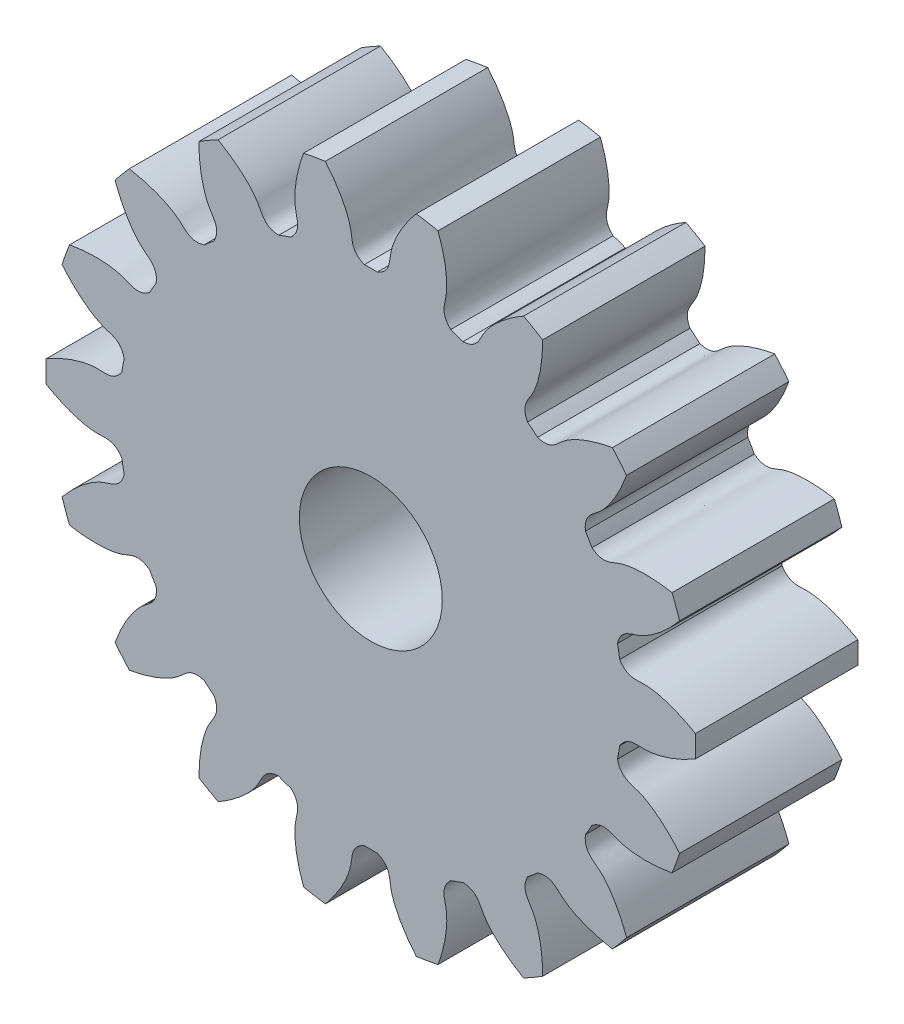
from build123d import *

# Parameters (mm, degrees)
SKETCH_1_R               = 5
EXTRUDE_1_DEPTH          = 2.5
CUT_EXTRUDE_1_DEPTH      = 8.5
PATTERN_CIRCULAR_1_COUNT = 18
CUT_EXTRUDE_2_REACH      = 9.467
SKETCH_4_R               = 1.1


with BuildPart() as part:
    # 草图1 → 凸台-拉伸1 (new body)
    with BuildSketch(Plane.XY):
        Circle(SKETCH_1_R)
    extrude(amount=EXTRUDE_1_DEPTH)

    # 草图2 → 切除-拉伸1 (cut, through all)
    with BuildSketch(Plane.XY):
        with BuildLine():
            ThreePointArc((0.09970178, 3.87371715), (0, 3.875), (-0.09970178, 3.87371715))
            add(Edge.make_bspline(
                [(-0.09970178, 3.87371715), (-0.30755202, 3.959340195), (-0.281394525, 4.119349751), (-0.315916457, 4.271297728), (-0.31937576, 4.2852533), (-0.323553797, 4.300770237), (-0.328512355, 4.317825091), (-0.334315015, 4.336392084), (-0.341023859, 4.356443666), (-0.348700427, 4.377950366), (-0.357405358, 4.400880864), (-0.367198437, 4.425201998), (-0.378138513, 4.450878789), (-0.39028346, 4.477874466), (-0.403690129, 4.50615049), (-0.418414299, 4.535666583), (-0.434510628, 4.566380752), (-0.452032612, 4.598249322), (-0.471032538, 4.631226962), (-0.491561435, 4.66526672), (-0.513669036, 4.700320051), (-0.537403731, 4.736336856), (-0.562812528, 4.77326551), (-0.589941007, 4.811052903), (-0.618833286, 4.849644473), (-0.649531974, 4.888984245), (-0.682078137, 4.929014872), (-0.716511262, 4.969677669), (-0.752869213, 5.010912657), (-0.791188202, 5.052658607), (-0.831502751, 5.094853076), (-0.87384566, 5.137432457), (-0.918247973, 5.180332018), (-0.964738945, 5.223485948), (-1.013346016, 5.266827406), (-1.064094777, 5.310288565), (-1.117008944, 5.353800659), (-1.17211033, 5.39729403), (-1.22941882, 5.440698182), (-1.288952349, 5.483941823), (-1.350726862, 5.526952923), (-1.437037676, 5.584519758), (-1.503777719, 5.626166889), (-1.549280445, 5.65333919)],
                knots=[0, 0, 0, 0, 0.187591972, 0.192996016, 0.1991206, 0.205965723, 0.213531386, 0.221817587, 0.230824328, 0.240551609, 0.250999428, 0.262167787, 0.274056685, 0.286666122, 0.299996099, 0.314046614, 0.32881767, 0.344309264, 0.360521397, 0.37745407, 0.395107283, 0.413481034, 0.432575325, 0.452390155, 0.472925524, 0.494181432, 0.51615788, 0.538854867, 0.562272393, 0.586410459, 0.611269064, 0.636848208, 0.663147891, 0.690168114, 0.717908876, 0.746370177, 0.775552017, 0.805454397, 0.836077316, 0.867420774, 0.899484772, 0.932269309, 1, 1, 1, 1], degree=3))
            ThreePointArc((-1.549280445, 5.65333919), (0, 5.86178419), (1.549280445, 5.65333919))
            add(Edge.make_bspline(
                [(0.09970178, 3.87371715), (0.30755202, 3.959340195), (0.281394525, 4.119349751), (0.315916457, 4.271297728), (0.31937576, 4.2852533), (0.323553797, 4.300770237), (0.328512355, 4.317825091), (0.334315015, 4.336392084), (0.341023859, 4.356443666), (0.348700427, 4.377950366), (0.357405358, 4.400880864), (0.367198437, 4.425201998), (0.378138513, 4.450878789), (0.39028346, 4.477874466), (0.403690129, 4.50615049), (0.418414299, 4.535666583), (0.434510628, 4.566380752), (0.452032612, 4.598249322), (0.471032538, 4.631226962), (0.491561435, 4.66526672), (0.513669036, 4.700320051), (0.537403731, 4.736336856), (0.562812528, 4.77326551), (0.589941007, 4.811052903), (0.618833286, 4.849644473), (0.649531974, 4.888984245), (0.682078137, 4.929014872), (0.716511262, 4.969677669), (0.752869213, 5.010912657), (0.791188202, 5.052658607), (0.831502751, 5.094853076), (0.87384566, 5.137432457), (0.918247973, 5.180332018), (0.964738945, 5.223485948), (1.013346016, 5.266827406), (1.064094777, 5.310288565), (1.117008944, 5.353800659), (1.17211033, 5.39729403), (1.22941882, 5.440698182), (1.288952349, 5.483941823), (1.350726862, 5.526952923), (1.437037676, 5.584519758), (1.503777719, 5.626166889), (1.549280445, 5.65333919)],
                knots=[0, 0, 0, 0, 0.187591972, 0.192996016, 0.1991206, 0.205965723, 0.213531386, 0.221817587, 0.230824328, 0.240551609, 0.250999428, 0.262167787, 0.274056685, 0.286666122, 0.299996099, 0.314046614, 0.32881767, 0.344309264, 0.360521397, 0.37745407, 0.395107283, 0.413481034, 0.432575325, 0.452390155, 0.472925524, 0.494181432, 0.51615788, 0.538854867, 0.562272393, 0.586410459, 0.611269064, 0.636848208, 0.663147891, 0.690168114, 0.717908876, 0.746370177, 0.775552017, 0.805454397, 0.836077316, 0.867420774, 0.899484772, 0.932269309, 1, 1, 1, 1], degree=3))
        make_face()
    cut_extrude_1 = extrude(amount=CUT_EXTRUDE_1_DEPTH, mode=Mode.SUBTRACT)

    # 阵列(圆周)1: 切除-拉伸1 ×18 about axis
    pattern_circular_1_axis = Axis((0, 0, 2.5), (0, 0, -1))
    for i in range(1, PATTERN_CIRCULAR_1_COUNT):
        add(cut_extrude_1.rotate(pattern_circular_1_axis, i * 360 / PATTERN_CIRCULAR_1_COUNT), mode=Mode.SUBTRACT)

    # 草图4 → 切除-拉伸2 (cut, up to next)
    with BuildSketch(Plane(origin=(0, 0, 0), x_dir=(-1, 0, 0), z_dir=(0, 0, -1)), mode=Mode.PRIVATE) as cut_extrude_2_sk1:
        Circle(SKETCH_4_R)
    cut_extrude_2_tool1 = extrude(cut_extrude_2_sk1.sketch, amount=-CUT_EXTRUDE_2_REACH, mode=Mode.PRIVATE) & part.part
    add(cut_extrude_2_tool1.solids().sort_by_distance((0, 0, 0))[0], mode=Mode.SUBTRACT)


solid = part.part
